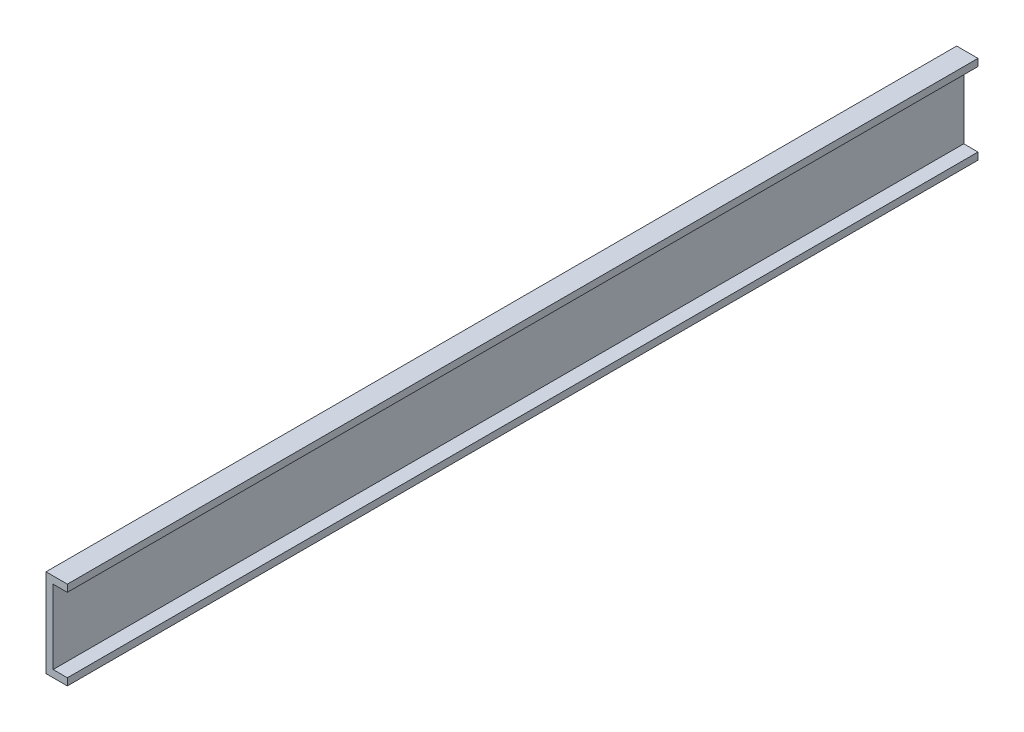
from build123d import *

# Parameters (mm, degrees)
SKETCH1_W           = 406.4
SKETCH1_H           = 39.37
BOSS_EXTRUDE1_DEPTH = 9.525
SKETCH2_W           = 6.35
SKETCH2_H           = 33.02
CUT_EXTRUDE1_DEPTH  = 409.413616968


with BuildPart() as part:
    # Sketch1 → Boss-Extrude1 (new body)
    with BuildSketch(Plane(origin=(0, 0, 0), x_dir=(0, 0, -1), z_dir=(1, 0, 0))):
        with Locations((203.2, 19.685)):
            Rectangle(SKETCH1_W, SKETCH1_H)
    extrude(amount=BOSS_EXTRUDE1_DEPTH)

    # Sketch2 → Cut-Extrude1 (cut, through all)
    with BuildSketch(Plane.XY):
        with Locations((6.35, 19.685)):
            Rectangle(SKETCH2_W, SKETCH2_H)
    extrude(amount=-CUT_EXTRUDE1_DEPTH, mode=Mode.SUBTRACT)


solid = part.part
